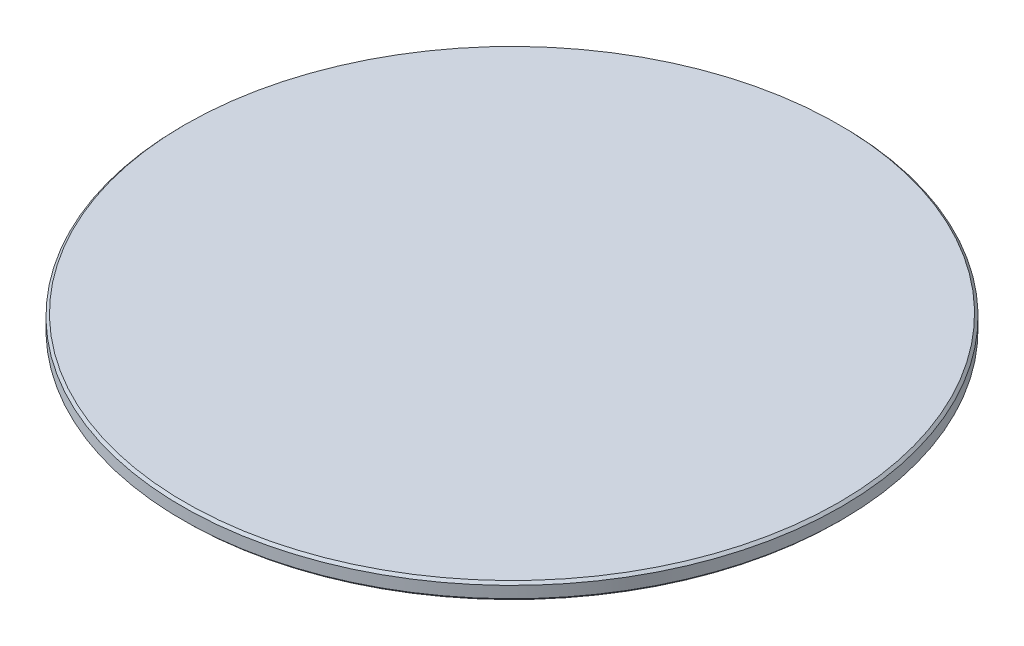
from build123d import *


with BuildPart() as part:
    # Esquisse1 → Révolution1 (revolve)
    with BuildSketch(Plane.XY, mode=Mode.PRIVATE) as r_volution1_sk:
        Polygon((0, 0), (19.85, 0), (20, 0.15), (20, 0.85), (19.85, 1), (0, 1), align=None)
    revolve(r_volution1_sk.sketch.rotate(Axis((0, 1, 0), (0, -1, 0)), 180), axis=Axis((0, 1, 0), (0, -1, 0)))


solid = part.part
